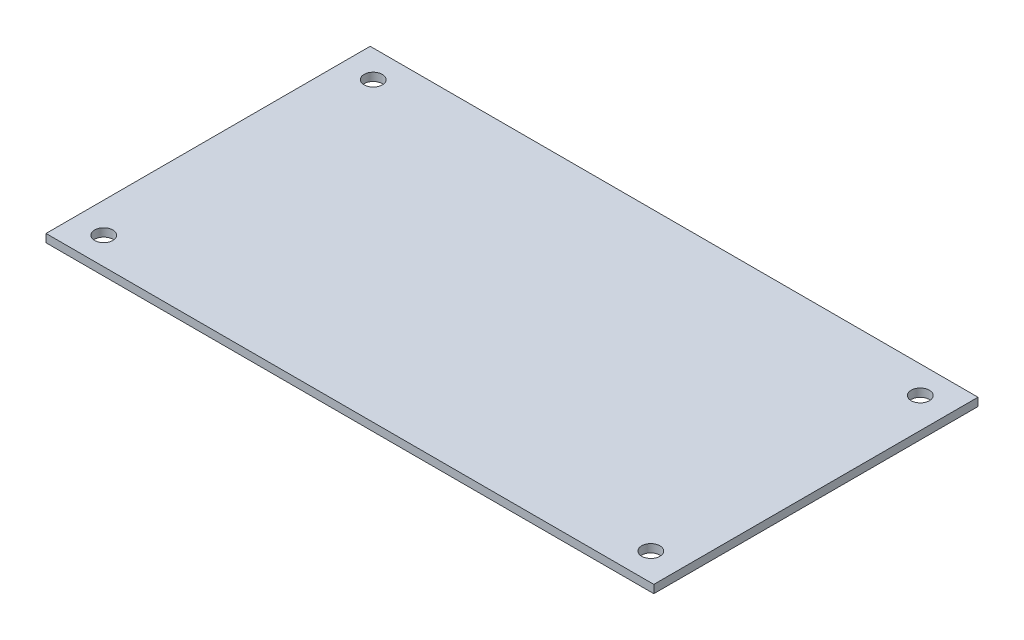
from build123d import *

# Parameters (mm, degrees)
SKETCH1_W           = 300
SKETCH1_H           = 160
BOSS_EXTRUDE2_DEPTH = 4
SKETCH3_R           = 4.5
CUT_EXTRUDE2_DEPTH  = 4


with BuildPart() as part:
    # Sketch1 → Boss-Extrude2 (new body)
    with BuildSketch(Plane(origin=(0, 0, 0), x_dir=(1, 0, 0), z_dir=(0, 1, 0))):
        with Locations((150, 80)):
            Rectangle(SKETCH1_W, SKETCH1_H)
    extrude(amount=BOSS_EXTRUDE2_DEPTH)

    # Sketch3 → Cut-Extrude2 (cut)
    with BuildSketch(Plane(origin=(0, 4, 0), x_dir=(1, 0, 0), z_dir=(0, 1, 0))):
        with Locations(Location((15, 146.5, 0), (0, 0, 270))):
            Circle(SKETCH3_R)
        with Locations(Location((285, 146.5, 0), (0, 0, 270))):
            Circle(SKETCH3_R)
        with Locations(Location((285, 13.5, 0), (0, 0, 270))):
            Circle(SKETCH3_R)
        with Locations(Location((15, 13.5, 0), (0, 0, 270))):
            Circle(SKETCH3_R)
    extrude(amount=-CUT_EXTRUDE2_DEPTH, mode=Mode.SUBTRACT)


solid = part.part
